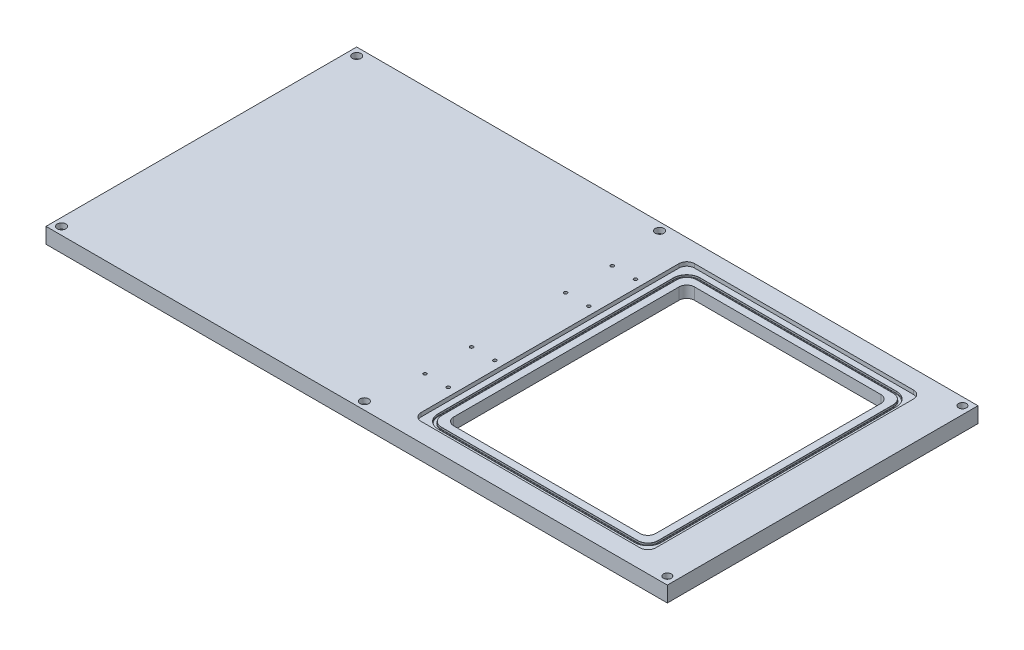
from build123d import *

# Parameters (mm, degrees)
SKETCH_1_W             = 800
SKETCH_1_H             = 400
EXTRUDE_1_DEPTH        = 20
SKETCH_3_W             = 302
SKETCH_3_H             = 352
CUT_EXTRUDE_1_DEPTH    = 5
CUT_EXTRUDE_2_DEPTH    = 2.7
FILLET_1_R             = 0.13
FILLET_2_R             = 0.5
FILLET_3_R             = 10
CUT_EXTRUDE_3_DEPTH    = 448.465082437
SKETCH_10_R            = 5.5
SKETCH_10_R_2          = 5
CUT_EXTRUDE_4_DEPTH    = 7
SKETCH_11_R            = 3.25
CUT_EXTRUDE_5_DEPTH    = 448.660585712
HOLE_WIZARD_M5_2_D     = 4.2
HOLE_WIZARD_M5_2_DEPTH = 14
HOLE_WIZARD_M5_2_TIP   = 1.2618073


with BuildPart() as part:
    # 스케치1 → 보스-돌출1 (new body)
    with BuildSketch(Plane(origin=(0, 0, 0), x_dir=(1, 0, 0), z_dir=(0, 1, 0))):
        Rectangle(SKETCH_1_W, SKETCH_1_H)
    extrude(amount=EXTRUDE_1_DEPTH)

    # 스케치3 → 컷-돌출1 (cut)
    with BuildSketch(Plane(origin=(0, 20, 0), x_dir=(1, 0, 0), z_dir=(0, 1, 0))):
        with Locations((200, 0)):
            Rectangle(SKETCH_3_W, SKETCH_3_H)
    extrude(amount=-CUT_EXTRUDE_1_DEPTH, mode=Mode.SUBTRACT)

    # 스케치4 → 컷-돌출2 (cut)
    with BuildSketch(Plane(origin=(0, 15, 0), x_dir=(1, 0, 0), z_dir=(0, 1, 0))):
        with BuildLine():
            Line((73.5, 168.55), (326.5, 168.55))
            ThreePointArc((326.5, 168.55), (338.556170619, 163.556170619), (343.55, 151.5))
            Line((343.55, 151.5), (343.55, -151.5))
            ThreePointArc((343.55, -151.5), (338.556170619, -163.556170619), (326.5, -168.55))
            Line((326.5, -168.55), (73.5, -168.55))
            ThreePointArc((73.5, -168.55), (61.443829381, -163.556170619), (56.45, -151.5))
            Line((56.45, -151.5), (56.45, 151.5))
            ThreePointArc((56.45, 151.5), (61.443829381, 163.556170619), (73.5, 168.55))
        make_face()
        with BuildLine():
            Line((73.5, 164.45), (326.5, 164.45))
            ThreePointArc((326.5, 164.45), (335.657032816, 160.657032816), (339.45, 151.5))
            Line((339.45, 151.5), (339.45, -151.5))
            ThreePointArc((339.45, -151.5), (335.657032816, -160.657032816), (326.5, -164.45))
            Line((326.5, -164.45), (73.5, -164.45))
            ThreePointArc((73.5, -164.45), (64.342967184, -160.657032816), (60.55, -151.5))
            Line((60.55, -151.5), (60.55, 151.5))
            ThreePointArc((60.55, 151.5), (64.342967184, 160.657032816), (73.5, 164.45))
        make_face(mode=Mode.SUBTRACT)
    extrude(amount=-CUT_EXTRUDE_2_DEPTH, mode=Mode.SUBTRACT)

    # 필렛1
    fillet_1_edges = [part.edges().sort_by_distance(p)[0] for p in [
        (61.443829381, 15, -163.556170619),
        (56.45, 15, 0),
        (61.443829381, 15, 163.556170619),
        (200, 15, 168.55),
        (338.556170619, 15, 163.556170619),
        (343.55, 15, 0),
        (338.556170619, 15, -163.556170619),
        (200, 15, -168.55),
        (64.342967184, 15, -160.657032816),
        (200, 15, -164.45),
        (335.657032816, 15, -160.657032816),
        (339.45, 15, 0),
        (335.657032816, 15, 160.657032816),
        (200, 15, 164.45),
        (64.342967184, 15, 160.657032816),
        (60.55, 15, 0),
    ]]
    fillet(fillet_1_edges, radius=FILLET_1_R)

    # 필렛2
    fillet_2_edges = [part.edges().sort_by_distance(p)[0] for p in [
        (61.443829381, 12.3, -163.556170619),
        (200, 12.3, -168.55),
        (338.556170619, 12.3, -163.556170619),
        (343.55, 12.3, 0),
        (338.556170619, 12.3, 163.556170619),
        (200, 12.3, 168.55),
        (61.443829381, 12.3, 163.556170619),
        (56.45, 12.3, 0),
        (200, 12.3, -164.45),
        (64.342967184, 12.3, -160.657032816),
        (60.55, 12.3, 0),
        (64.342967184, 12.3, 160.657032816),
        (200, 12.3, 164.45),
        (335.657032816, 12.3, 160.657032816),
        (339.45, 12.3, 0),
        (335.657032816, 12.3, -160.657032816),
    ]]
    fillet(fillet_2_edges, radius=FILLET_2_R)

    # 필렛3
    fillet_3_edges = [part.edges().sort_by_distance(p)[0] for p in [
        (351, 17.5, -176),
        (351, 17.5, 176),
        (49, 17.5, 176),
        (49, 17.5, -176),
    ]]
    fillet(fillet_3_edges, radius=FILLET_3_R)

    # 스케치6 → 컷-돌출3 (cut, through all)
    with BuildSketch(Plane(origin=(0, 15, 0), x_dir=(1, 0, 0), z_dir=(0, 1, 0))):
        with BuildLine():
            Line((80, 155), (320, 155))
            ThreePointArc((320, 155), (327.071067812, 152.071067812), (330, 145))
            Line((330, 145), (330, -145))
            ThreePointArc((330, -145), (327.071067812, -152.071067812), (320, -155))
            Line((320, -155), (80, -155))
            ThreePointArc((80, -155), (72.928932188, -152.071067812), (70, -145))
            Line((70, -145), (70, 145))
            ThreePointArc((70, 145), (72.928932188, 152.071067812), (80, 155))
        make_face()
    extrude(amount=-CUT_EXTRUDE_3_DEPTH, mode=Mode.SUBTRACT)

    # 스케치10 → 컷-돌출4 (cut)
    with BuildSketch(Plane(origin=(0, 20, 0), x_dir=(1, 0, 0), z_dir=(0, 1, 0))):
        with Locations(Location((0, 190, 0), (0, 0, 270))):
            Circle(SKETCH_10_R)
        with Locations(Location((-390, 190, 0), (0, 0, 270))):
            Circle(SKETCH_10_R)
        with Locations(Location((-390, -190, 0), (0, 0, 270))):
            Circle(SKETCH_10_R)
        with Locations(Location((0, -190, 0), (0, 0, 270))):
            Circle(SKETCH_10_R)
        with Locations(Location((390, -190, 0), (0, 0, 270))):
            Circle(SKETCH_10_R_2)
        with Locations(Location((390, 190, 0), (0, 0, 270))):
            Circle(SKETCH_10_R_2)
    extrude(amount=-CUT_EXTRUDE_4_DEPTH, mode=Mode.SUBTRACT)

    # 스케치11 → 컷-돌출5 (cut, through all)
    with BuildSketch(Plane(origin=(0, 20, 0), x_dir=(1, 0, 0), z_dir=(0, 1, 0))):
        with Locations(Location((-390, 190, 0), (0, 0, 270))):
            Circle(SKETCH_11_R)
        with Locations(Location((0, 190, 0), (0, 0, 270))):
            Circle(SKETCH_11_R)
        with Locations(Location((0, -190, 0), (0, 0, 270))):
            Circle(SKETCH_11_R)
        with Locations(Location((-390, -190, 0), (0, 0, 270))):
            Circle(SKETCH_11_R)
        with Locations(Location((390, -190, 0), (0, 0, 270))):
            Circle(SKETCH_11_R)
        with Locations(Location((390, 190, 0), (0, 0, 270))):
            Circle(SKETCH_11_R)
    extrude(amount=-CUT_EXTRUDE_5_DEPTH, mode=Mode.SUBTRACT)

    # M5 나사 구멍2
    with Locations(Plane(origin=(0, 20, 0), x_dir=(1, 0, 0), z_dir=(0, 1, 0))):
        with Locations((8.5, 120.5), (38.5, 120.5), (8.5, 60.5), (38.5, 60.5), (8.5, -60.5), (38.5, -60.5), (8.5, -120.5), (38.5, -120.5)):
            Hole(HOLE_WIZARD_M5_2_D / 2, depth=HOLE_WIZARD_M5_2_DEPTH)
            with Locations((0, 0, -(HOLE_WIZARD_M5_2_DEPTH + HOLE_WIZARD_M5_2_TIP / 2))):  # 118° drill point
                Cone(0, HOLE_WIZARD_M5_2_D / 2, HOLE_WIZARD_M5_2_TIP, mode=Mode.SUBTRACT)


solid = part.part
